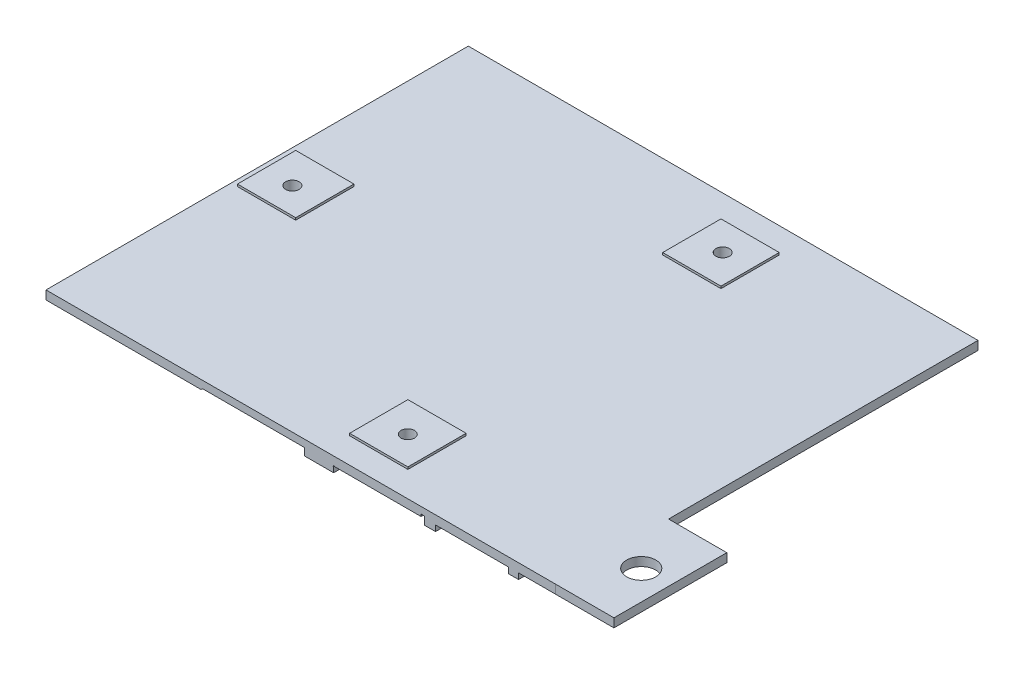
from build123d import *

# Parameters (mm, degrees)
SKETCH_1_W                       = 700
SKETCH_1_H                       = 580
EXTRUDE_1_DEPTH                  = 20
EXTRUDE_2_DEPTH                  = 12
CUT_EXTRUDE_1_REACH              = 521.038
SKETCH_3_R                       = 20
CUT_EXTRUDE_2_REACH              = 724.288
CUT_EXTRUDE_3_REACH              = 724.288
CUT_EXTRUDE_4_REACH              = 724.288
SKETCH_6_W                       = 100
SKETCH_6_H                       = 8
CUT_EXTRUDE_5_REACH              = 610.872
SKETCH_7_R                       = 2
CUT_EXTRUDE_6_REACH              = 610.872
SKETCH_8_R                       = 2
PATTERN_LINEAR_1_COUNT           = 5
PATTERN_LINEAR_1_PITCH           = 20
CUT_EXTRUDE_7_REACH              = 724.288
SKETCH_9_W                       = 131
SKETCH_9_H                       = 8
SKETCH_13_R                      = 5.5
CUT_EXTRUDE_10_DEPTH             = 5
PATTERN_LINEAR_2_COUNT           = 2
PATTERN_LINEAR_2_PITCH           = 300
PATTERN_LINEAR_3_COUNT           = 2
PATTERN_LINEAR_3_PITCH           = 325
PATTERN_LINEAR_3_COPY_1_SKETCH_R = 5.5
PATTERN_LINEAR_3_COPY_1_DEPTH    = 5
SKETCH_15_W                      = 80
SKETCH_15_H                      = 80
EXTRUDE_3_DEPTH                  = 3
SKETCH_16_R                      = 9.25
CUT_EXTRUDE_11_DEPTH             = 520.16212535
SKETCH_15_3_R                    = 9.25
CUT_EXTRUDE_12_DEPTH             = 15


with BuildPart() as part:
    # 草图1 → 凸台-拉伸1 (new body)
    with BuildSketch(Plane(origin=(0, 0, 0), x_dir=(1, 0, 0), z_dir=(0, 1, 0))):
        Rectangle(SKETCH_1_W, SKETCH_1_H)
    extrude(amount=EXTRUDE_1_DEPTH)

    # 草图2 → 凸台-拉伸2 (add)
    with BuildSketch(Plane(origin=(0, 20, 0), x_dir=(1, 0, 0), z_dir=(0, 1, 0))):
        Polygon((350, -135.000538617), (350, -290), (430, -290.000538617), (430, -135.000538617), align=None)
    extrude(amount=-EXTRUDE_2_DEPTH)

    # 草图3 → 切除-拉伸1 (cut, up to next)
    with BuildSketch(Plane(origin=(0, 20, 0), x_dir=(1, 0, 0), z_dir=(0, 1, 0)), mode=Mode.PRIVATE) as cut_extrude_1_sk1:
        with Locations((390, -212.500538617)):
            Circle(SKETCH_3_R)
    cut_extrude_1_tool1 = extrude(cut_extrude_1_sk1.sketch, amount=-CUT_EXTRUDE_1_REACH, mode=Mode.PRIVATE) & part.part
    add(cut_extrude_1_tool1.solids().sort_by_distance((390, 20, 212.500539))[0], mode=Mode.SUBTRACT)

    # 草图4 → 切除-拉伸2 (cut, up to next)
    with BuildSketch(Plane(origin=(0, 0, -290), x_dir=(-1, 0, 0), z_dir=(0, 0, -1)), mode=Mode.PRIVATE) as cut_extrude_2_sk1:
        Polygon((-170, 0), (-170, 8), (-170, 11), (-165, 11), (-165, 8), (-46.060660172, 8), (-45.353553391, 8.707106781), (-44.292893219, 7.646446609), (-45, 6.939339828), (-45, 0), align=None)
    cut_extrude_2_tool1 = extrude(cut_extrude_2_sk1.sketch, amount=-CUT_EXTRUDE_2_REACH, mode=Mode.PRIVATE) & part.part
    add(cut_extrude_2_tool1.solids().sort_by_distance((108.328272, 4.084832, -290))[0], mode=Mode.SUBTRACT)

    # 草图5 → 切除-拉伸3 (cut, up to next)
    with BuildSketch(Plane(origin=(0, 0, -290), x_dir=(-1, 0, 0), z_dir=(0, 0, -1)), mode=Mode.PRIVATE) as cut_extrude_3_sk1:
        Polygon((-5, 0), (-5, 10), (135, 10), (137, 8), (350, 8), (350, 0), (167, 0), align=None)
    cut_extrude_3_tool1 = extrude(cut_extrude_3_sk1.sketch, amount=-CUT_EXTRUDE_3_REACH, mode=Mode.PRIVATE) & part.part
    add(cut_extrude_3_tool1.solids().sort_by_distance((-162.835148, 4.45142, -290))[0], mode=Mode.SUBTRACT)

    # 草图6 → 切除-拉伸4 (cut, up to next)
    with BuildSketch(Plane(origin=(0, 0, -290), x_dir=(-1, 0, 0), z_dir=(0, 0, -1)), mode=Mode.PRIVATE) as cut_extrude_4_sk1:
        with Locations((-235, 4)):
            Rectangle(SKETCH_6_W, SKETCH_6_H)
    cut_extrude_4_tool1 = extrude(cut_extrude_4_sk1.sketch, amount=-CUT_EXTRUDE_4_REACH, mode=Mode.PRIVATE) & part.part
    add(cut_extrude_4_tool1.solids().sort_by_distance((235, 4, -290))[0], mode=Mode.SUBTRACT)

    # 草图7 → 切除-拉伸5 (cut, up to next)
    with BuildSketch(Plane(origin=(185, 0, 0), x_dir=(0, 0, -1), z_dir=(1, 0, 0)), mode=Mode.PRIVATE) as cut_extrude_5_sk1:
        with Locations((200, 4)):
            Circle(SKETCH_7_R)
    cut_extrude_5_tool1 = extrude(cut_extrude_5_sk1.sketch, amount=-CUT_EXTRUDE_5_REACH, mode=Mode.PRIVATE) & part.part
    # 草图7 → 切除-拉伸5 (cut, up to next)
    with BuildSketch(Plane(origin=(185, 0, 0), x_dir=(0, 0, -1), z_dir=(1, 0, 0)), mode=Mode.PRIVATE) as cut_extrude_5_sk2:
        with Locations((180, 4)):
            Circle(SKETCH_7_R)
    cut_extrude_5_tool2 = extrude(cut_extrude_5_sk2.sketch, amount=-CUT_EXTRUDE_5_REACH, mode=Mode.PRIVATE) & part.part
    # 草图7 → 切除-拉伸5 (cut, up to next)
    with BuildSketch(Plane(origin=(185, 0, 0), x_dir=(0, 0, -1), z_dir=(1, 0, 0)), mode=Mode.PRIVATE) as cut_extrude_5_sk3:
        with Locations((160, 4)):
            Circle(SKETCH_7_R)
    cut_extrude_5_tool3 = extrude(cut_extrude_5_sk3.sketch, amount=-CUT_EXTRUDE_5_REACH, mode=Mode.PRIVATE) & part.part
    # 草图7 → 切除-拉伸5 (cut, up to next)
    with BuildSketch(Plane(origin=(185, 0, 0), x_dir=(0, 0, -1), z_dir=(1, 0, 0)), mode=Mode.PRIVATE) as cut_extrude_5_sk4:
        with Locations((140, 4)):
            Circle(SKETCH_7_R)
    cut_extrude_5_tool4 = extrude(cut_extrude_5_sk4.sketch, amount=-CUT_EXTRUDE_5_REACH, mode=Mode.PRIVATE) & part.part
    # 草图7 → 切除-拉伸5 (cut, up to next)
    with BuildSketch(Plane(origin=(185, 0, 0), x_dir=(0, 0, -1), z_dir=(1, 0, 0)), mode=Mode.PRIVATE) as cut_extrude_5_sk5:
        with Locations((120, 4)):
            Circle(SKETCH_7_R)
    cut_extrude_5_tool5 = extrude(cut_extrude_5_sk5.sketch, amount=-CUT_EXTRUDE_5_REACH, mode=Mode.PRIVATE) & part.part
    add(cut_extrude_5_tool1.solids().sort_by_distance((185, 4, -200))[0], mode=Mode.SUBTRACT)
    add(cut_extrude_5_tool2.solids().sort_by_distance((185, 4, -180))[0], mode=Mode.SUBTRACT)
    add(cut_extrude_5_tool3.solids().sort_by_distance((185, 4, -160))[0], mode=Mode.SUBTRACT)
    add(cut_extrude_5_tool4.solids().sort_by_distance((185, 4, -140))[0], mode=Mode.SUBTRACT)
    add(cut_extrude_5_tool5.solids().sort_by_distance((185, 4, -120))[0], mode=Mode.SUBTRACT)

    # 草图8 → 切除-拉伸6 (cut, up to next)
    with BuildSketch(Plane(origin=(185, 0, 0), x_dir=(0, 0, -1), z_dir=(1, 0, 0)), mode=Mode.PRIVATE) as cut_extrude_6_sk1:
        with Locations((-125, 4)):
            Circle(SKETCH_8_R)
    cut_extrude_6_tool1 = extrude(cut_extrude_6_sk1.sketch, amount=-CUT_EXTRUDE_6_REACH, mode=Mode.PRIVATE) & part.part
    cut_extrude_6 = cut_extrude_6_tool1.solids().sort_by_distance((185, 4, 125))[0]
    add(cut_extrude_6, mode=Mode.SUBTRACT)

    # 阵列(线性)1: 切除-拉伸6 ×5
    with Locations(*[(0, 0, i * PATTERN_LINEAR_1_PITCH) for i in range(1, PATTERN_LINEAR_1_COUNT)]):
        add(cut_extrude_6, mode=Mode.SUBTRACT)

    # 草图9 → 切除-拉伸7 (cut, up to next)
    with BuildSketch(Plane.XY.offset(290), mode=Mode.PRIVATE) as cut_extrude_7_sk1:
        with Locations((364.5, 4)):
            Rectangle(SKETCH_9_W, SKETCH_9_H)
    cut_extrude_7_tool1 = extrude(cut_extrude_7_sk1.sketch, amount=-CUT_EXTRUDE_7_REACH, mode=Mode.PRIVATE) & part.part
    add(cut_extrude_7_tool1.solids().sort_by_distance((364.5, 4, 290))[0], mode=Mode.SUBTRACT)

    # 草图13 → 切除-拉伸10 (cut)
    with BuildSketch(Plane.XZ.offset(-8)):
        with Locations((-245, 137.5)):
            Circle(SKETCH_13_R)
        with Locations((-245, 197.5)):
            Circle(SKETCH_13_R)
        with Locations((-145, 197.5)):
            Circle(SKETCH_13_R)
        with Locations((-145, 137.5)):
            Circle(SKETCH_13_R)
    cut_extrude_10 = extrude(amount=-CUT_EXTRUDE_10_DEPTH, mode=Mode.SUBTRACT)

    # 阵列(线性)2: 切除-拉伸10 ×2
    with Locations(*[(i * PATTERN_LINEAR_2_PITCH, 0, 0) for i in range(1, PATTERN_LINEAR_2_COUNT)]):
        add(cut_extrude_10, mode=Mode.SUBTRACT)

    # 阵列(线性)3: 切除-拉伸10 ×2
    with Locations(*[(0, 0, -i * PATTERN_LINEAR_3_PITCH) for i in range(1, PATTERN_LINEAR_3_COUNT)]):
        add(cut_extrude_10, mode=Mode.SUBTRACT)

    # 阵列(线性)3 copy 1 sketch → 阵列(线性)3 copy 1 (cut)
    with BuildSketch(Plane(origin=(300, 8, -325), x_dir=(1, 0, 0), z_dir=(0, -1, 0))):
        with Locations((-245, 137.5)):
            Circle(PATTERN_LINEAR_3_COPY_1_SKETCH_R)
        with Locations((-245, 197.5)):
            Circle(PATTERN_LINEAR_3_COPY_1_SKETCH_R)
        with Locations((-145, 197.5)):
            Circle(PATTERN_LINEAR_3_COPY_1_SKETCH_R)
        with Locations((-145, 137.5)):
            Circle(PATTERN_LINEAR_3_COPY_1_SKETCH_R)
    extrude(amount=-PATTERN_LINEAR_3_COPY_1_DEPTH, mode=Mode.SUBTRACT)

    # 草图15 → 凸台-拉伸3 (add)
    with BuildSketch(Plane(origin=(0, 20, 0), x_dir=(1, 0, 0), z_dir=(0, 1, 0))):
        with Locations((72, -215)):
            Rectangle(SKETCH_15_W, SKETCH_15_H)
        with Locations((72, 215)):
            Rectangle(SKETCH_15_W, SKETCH_15_H)
        with Locations((-301.459594093, 4.399478147)):
            Rectangle(SKETCH_15_W, SKETCH_15_H)
    extrude(amount=EXTRUDE_3_DEPTH)

    # 草图16 → 切除-拉伸11 (cut, through all)
    with BuildSketch(Plane(origin=(0, 23, 0), x_dir=(1, 0, 0), z_dir=(0, 1, 0))):
        with Locations((-301.914277382, 0.259141217)):
            Circle(SKETCH_16_R)
    extrude(amount=-CUT_EXTRUDE_11_DEPTH, mode=Mode.SUBTRACT)

    # 草图15<3> → 切除-拉伸12 (cut, symmetric)
    with BuildSketch(Plane(origin=(0, 20, 0), x_dir=(1, 0, 0), z_dir=(0, 1, 0))):
        with Locations((73.085716832, -216.247219752)):
            Circle(SKETCH_15_3_R)
        with Locations((73.085716832, 216.247219752)):
            Circle(SKETCH_15_3_R)
    extrude(amount=CUT_EXTRUDE_12_DEPTH, both=True, mode=Mode.SUBTRACT)


solid = part.part
